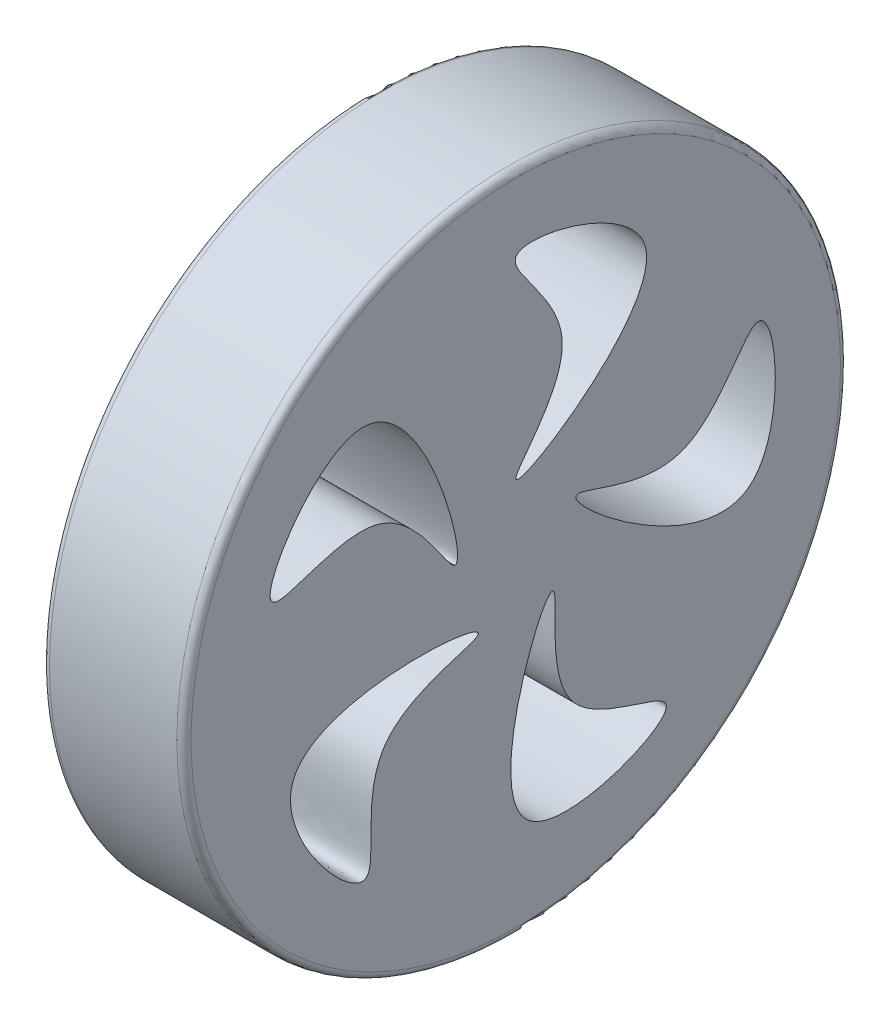
from build123d import *

# Parameters (mm, degrees)
SKETCH1_R           = 46.88
BOSS_EXTRUDE1_DEPTH = 20
CUT_EXTRUDE1_REACH  = 71.249
FILLET2_R           = 1


with BuildPart() as part:
    # Sketch1 → Boss-Extrude1 (new body)
    with BuildSketch(Plane(origin=(0, 0, 0), x_dir=(0, 0, -1), z_dir=(1, 0, 0))):
        Circle(SKETCH1_R)
    extrude(amount=BOSS_EXTRUDE1_DEPTH)

    # Sketch3 → Cut-Extrude1 (cut, up to next)
    with BuildSketch(Plane(origin=(20, 0, 0), x_dir=(0, 0, -1), z_dir=(1, 0, 0)), mode=Mode.PRIVATE) as cut_extrude1_sk1:
        with BuildLine():
            add(Edge.make_bspline(
                [(-1.46e-07, 9.119339347), (0.060516465, 10.431440134), (13.531015459, 22.882352379), (-10.380367826, 41.627015345), (36.551306882, 29.75795013), (-0.108166639, 6.774109847), (-1.46e-07, 9.119339347)],
                knots=[0, 0, 0, 0, 0.194965488, 0.393018955, 0.651521577, 1, 1, 1, 1], degree=3))
        make_face()
    cut_extrude1_tool1 = extrude(cut_extrude1_sk1.sketch, amount=-CUT_EXTRUDE1_REACH, mode=Mode.PRIVATE) & part.part
    # Sketch3 → Cut-Extrude1 (cut, up to next)
    with BuildSketch(Plane(origin=(20, 0, 0), x_dir=(0, 0, -1), z_dir=(1, 0, 0)), mode=Mode.PRIVATE) as cut_extrude1_sk2:
        with BuildLine():
            add(Edge.make_bspline(
                [(8.673007313, 2.818030902), (9.939589964, 3.165937633), (25.943724031, -5.797724475), (36.381934165, 22.735771362), (39.59646716, -25.566645899), (6.409136243, 2.196187563), (8.673007313, 2.818030902)],
                knots=[0, 0, 0, 0, 0.194965486, 0.393018955, 0.651521577, 1, 1, 1, 1], degree=3))
        make_face()
    cut_extrude1_tool2 = extrude(cut_extrude1_sk2.sketch, amount=-CUT_EXTRUDE1_REACH, mode=Mode.PRIVATE) & part.part
    # Sketch3 → Cut-Extrude1 (cut, up to next)
    with BuildSketch(Plane(origin=(20, 0, 0), x_dir=(0, 0, -1), z_dir=(1, 0, 0)), mode=Mode.PRIVATE) as cut_extrude1_sk3:
        with BuildLine():
            add(Edge.make_bspline(
                [(5.360213304, -7.377700682), (6.082487832, -8.474783273), (2.503087981, -26.465543188), (32.865639452, -27.575535832), (-12.079343913, -45.559006187), (4.069230511, -5.416791508), (5.360213304, -7.377700682)],
                knots=[0, 0, 0, 0, 0.194965486, 0.393018955, 0.651521577, 1, 1, 1, 1], degree=3))
        make_face()
    cut_extrude1_tool3 = extrude(cut_extrude1_sk3.sketch, amount=-CUT_EXTRUDE1_REACH, mode=Mode.PRIVATE) & part.part
    # Sketch3 → Cut-Extrude1 (cut, up to next)
    with BuildSketch(Plane(origin=(20, 0, 0), x_dir=(0, 0, -1), z_dir=(1, 0, 0)), mode=Mode.PRIVATE) as cut_extrude1_sk4:
        with BuildLine():
            add(Edge.make_bspline(
                [(-5.360213304, -7.377700682), (-6.180405747, -8.403641743), (-24.396730582, -10.558880746), (-16.069851922, -39.778389764), (-47.06191226, -2.590368418), (-3.894213479, -5.543948824), (-5.360213304, -7.377700682)],
                knots=[0, 0, 0, 0, 0.194965486, 0.393018955, 0.651521577, 1, 1, 1, 1], degree=3))
        make_face()
    cut_extrude1_tool4 = extrude(cut_extrude1_sk4.sketch, amount=-CUT_EXTRUDE1_REACH, mode=Mode.PRIVATE) & part.part
    # Sketch3 → Cut-Extrude1 (cut, up to next)
    with BuildSketch(Plane(origin=(20, 0, 0), x_dir=(0, 0, -1), z_dir=(1, 0, 0)), mode=Mode.PRIVATE) as cut_extrude1_sk5:
        with BuildLine():
            add(Edge.make_bspline(
                [(-8.673007313, 2.818030902), (-9.902188648, 3.281047046), (-17.581096695, 19.939796004), (-42.797354134, 2.99113894), (-17.006517439, 43.958070461), (-6.4759868, 1.990442703), (-8.673007313, 2.818030902)],
                knots=[0, 0, 0, 0, 0.194965486, 0.393018955, 0.651521577, 1, 1, 1, 1], degree=3))
        make_face()
    cut_extrude1_tool5 = extrude(cut_extrude1_sk5.sketch, amount=-CUT_EXTRUDE1_REACH, mode=Mode.PRIVATE) & part.part
    add(cut_extrude1_tool1.solids().sort_by_distance((20, 25.258672, -9.373721))[0], mode=Mode.SUBTRACT)
    add(cut_extrude1_tool2.solids().sort_by_distance((20, -1.106293, -26.922344))[0], mode=Mode.SUBTRACT)
    add(cut_extrude1_tool3.solids().sort_by_distance((20, -25.944828, -7.283022))[0], mode=Mode.SUBTRACT)
    add(cut_extrude1_tool4.solids().sort_by_distance((20, -14.912682, 22.439569))[0], mode=Mode.SUBTRACT)
    add(cut_extrude1_tool5.solids().sort_by_distance((20, 16.723546, 21.13037))[0], mode=Mode.SUBTRACT)

    # Fillet2
    fillet2_edges = [part.edges().sort_by_distance(p)[0] for p in [
        (0, 0, 46.88),
        (20, 0, 46.88),
    ]]
    fillet(fillet2_edges, radius=FILLET2_R)


solid = part.part
